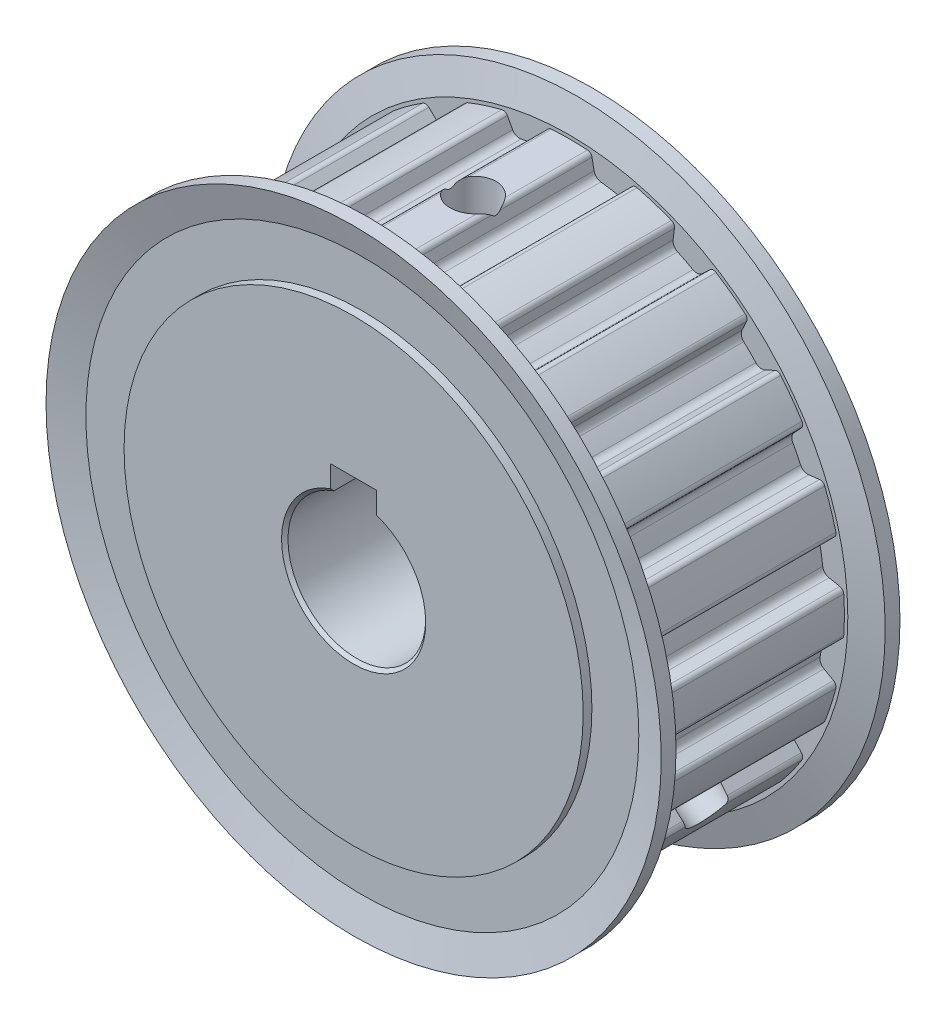
from build123d import *

# Parameters (mm, degrees)
EXTRUDE_1_DEPTH                  = 10.5
FILLET_1_R                       = 0.54
FILLET_2_R                       = 0.86
PATTERN_CIRCULAR_1_COUNT         = 20
FILLET_1_OF_PATTERN_CIRCULAR_1_R = 0.54
FILLET_2_OF_PATTERN_CIRCULAR_1_R = 0.86
CUT_EXTRUDE_2_DEPTH              = 50.127385438
CUT_EXTRUDE_2_DEPTH_BACK         = 50.127385438
CHAMFER_2_SIZE                   = 0.35
CUT_EXTRUDE_START                = 9.8
SKETCH_15_R                      = 2.5
CUT_EXTRUDE_3_DEPTH              = 40.327385438
SKETCH_16_R                      = 2.5
CUT_EXTRUDE_4_DEPTH              = 50.127385438


with BuildPart() as part:
    # 草图3 → 旋转1 (revolve)
    with BuildSketch(Plane(origin=(0, 0, 0), x_dir=(0, 0, -1), z_dir=(1, 0, 0)), mode=Mode.PRIVATE) as revolve_1_sk:
        Polygon((13, 0), (13, 25), (12.05, 25), (12.05, 30.107096992), (13, 33.5), (11.390387964, 33.5), (10.5, 30.32), (10.5, 27.8), (-10.5, 27.8), (-10.5, 30.32), (-11.390387964, 33.5), (-13, 33.5), (-12.05, 30.107096992), (-12.05, 25), (-13, 25), (-13, 0), align=None)
    revolve(revolve_1_sk.sketch.rotate(Axis((0, 0, 13), (0, 0, -1)), 90), axis=Axis((0, 0, 13), (0, 0, -1)))

    # 草图4 → 凸台-拉伸1 (add, symmetric)
    with BuildSketch(Plane.XY):
        with BuildLine():
            Line((-2.806214147, 27.658003582), (-2.381072316, 29.845168698))
            ThreePointArc((-2.381072316, 29.845168698), (0, 29.94), (2.381072316, 29.845168698))
            Line((2.381072316, 29.845168698), (2.806214147, 27.658003582))
            ThreePointArc((2.806214147, 27.658003582), (0, 27.8), (-2.806214147, 27.658003582))
        make_face()
    extrude_1 = extrude(amount=EXTRUDE_1_DEPTH, both=True)

    # 圆角1
    fillet_1_edges = [part.edges().sort_by_distance(p)[0] for p in [
        (2.381072316, 29.845168698, 0),
        (-2.381072316, 29.845168698, 0),
    ]]
    fillet(fillet_1_edges, radius=FILLET_1_R)

    # 圆角2
    fillet_2_edges = [part.edges().sort_by_distance(p)[0] for p in [
        (-2.806214147, 27.658003582, 0),
        (2.806214147, 27.658003582, 0),
    ]]
    fillet(fillet_2_edges, radius=FILLET_2_R)

    # 阵列(圆周)1: 凸台-拉伸1 ×20 about axis
    pattern_circular_1_axis = Axis((0, 0, 0), (0, 0, 1))
    for i in range(1, PATTERN_CIRCULAR_1_COUNT):
        add(extrude_1.rotate(pattern_circular_1_axis, i * 360 / PATTERN_CIRCULAR_1_COUNT))

    # 圆角1 of 阵列(圆周)1
    fillet_1_of_pattern_circular_1_edges = [part.edges().sort_by_distance(p)[0] for p in [
        (-6.958129986, 29.120233981, 0),
        (-11.48719867, 27.64865036, 0),
        (-15.616222045, 25.544807869, 0),
        (-19.468877981, 22.745689485, 0),
        (-22.745689485, 19.468877981, 0),
        (-25.544807869, 15.616222045, 0),
        (-27.64865036, 11.48719867, 0),
        (-29.120233981, 6.958129986, 0),
        (-29.845168698, 2.381072316, 0),
        (-29.845168698, -2.381072316, 0),
        (-29.120233981, -6.958129986, 0),
        (-27.64865036, -11.48719867, 0),
        (-25.544807869, -15.616222045, 0),
        (-22.745689485, -19.468877981, 0),
        (-19.468877981, -22.745689485, 0),
        (-15.616222045, -25.544807869, 0),
        (-11.48719867, -27.64865036, 0),
        (-6.958129986, -29.120233981, 0),
        (-2.381072316, -29.845168698, 0),
        (2.381072316, -29.845168698, 0),
        (6.958129986, -29.120233981, 0),
        (11.48719867, -27.64865036, 0),
        (15.616222045, -25.544807869, 0),
        (19.468877981, -22.745689485, 0),
        (22.745689485, -19.468877981, 0),
        (25.544807869, -15.616222045, 0),
        (27.64865036, -11.48719867, 0),
        (29.120233981, -6.958129986, 0),
        (29.845168698, -2.381072316, 0),
        (29.845168698, 2.381072316, 0),
        (29.120233981, 6.958129986, 0),
        (27.64865036, 11.48719867, 0),
        (25.544807869, 15.616222045, 0),
        (22.745689485, 19.468877981, 0),
        (19.468877981, 22.745689485, 0),
        (15.616222045, 25.544807869, 0),
        (11.48719867, 27.64865036, 0),
        (6.958129986, 29.120233981, 0),
    ]]
    fillet(fillet_1_of_pattern_circular_1_edges, radius=FILLET_1_OF_PATTERN_CIRCULAR_1_R)

    # 圆角2 of 阵列(圆周)1
    fillet_2_of_pattern_circular_1_edges = [part.edges().sort_by_distance(p)[0] for p in [
        (-11.215661388, 25.437156673, 0),
        (-5.877924887, 27.171492396, 0),
        (-18.527241549, 20.726343638, 0),
        (-13.986691679, 24.025246219, 0),
        (-24.025246219, 13.986691679, 0),
        (-20.726343638, 18.527241549, 0),
        (-27.171492396, 5.877924887, 0),
        (-25.437156673, 11.215661388, 0),
        (-27.658003582, -2.806214147, 0),
        (-27.658003582, 2.806214147, 0),
        (-25.437156673, -11.215661388, 0),
        (-27.171492396, -5.877924887, 0),
        (-20.726343638, -18.527241549, 0),
        (-24.025246219, -13.986691679, 0),
        (-13.986691679, -24.025246219, 0),
        (-18.527241549, -20.726343638, 0),
        (-5.877924887, -27.171492396, 0),
        (-11.215661388, -25.437156673, 0),
        (2.806214147, -27.658003582, 0),
        (-2.806214147, -27.658003582, 0),
        (11.215661388, -25.437156673, 0),
        (5.877924887, -27.171492396, 0),
        (18.527241549, -20.726343638, 0),
        (13.986691679, -24.025246219, 0),
        (24.025246219, -13.986691679, 0),
        (20.726343638, -18.527241549, 0),
        (27.171492396, -5.877924887, 0),
        (25.437156673, -11.215661388, 0),
        (27.658003582, 2.806214147, 0),
        (27.658003582, -2.806214147, 0),
        (25.437156673, 11.215661388, 0),
        (27.171492396, 5.877924887, 0),
        (20.726343638, 18.527241549, 0),
        (24.025246219, 13.986691679, 0),
        (13.986691679, 24.025246219, 0),
        (18.527241549, 20.726343638, 0),
        (5.877924887, 27.171492396, 0),
        (11.215661388, 25.437156673, 0),
    ]]
    fillet(fillet_2_of_pattern_circular_1_edges, radius=FILLET_2_OF_PATTERN_CIRCULAR_1_R)

    # 草图9 → 切除-拉伸2 (cut, two sides: drawn at the far end of the back side and taken through both)
    with BuildSketch(Plane.XY.offset(-CUT_EXTRUDE_2_DEPTH_BACK)):
        with BuildLine():
            Line((-2.5, 7.071067812), (-2.5, 9.8))
            Line((-2.5, 9.8), (2.5, 9.8))
            Line((2.5, 9.8), (2.5, 7.071067812))
            ThreePointArc((2.5, 7.071067812), (0, -7.5), (-2.5, 7.071067812))
        make_face()
    extrude(amount=CUT_EXTRUDE_2_DEPTH + CUT_EXTRUDE_2_DEPTH_BACK, mode=Mode.SUBTRACT)

    # 倒角2
    chamfer_2_edges = [part.edges().sort_by_distance(p)[0] for p in [
        (0, -7.5, -13),
        (0, -7.5, 13),
    ]]
    chamfer(chamfer_2_edges, length=CHAMFER_2_SIZE)

    # 草图15 → 切除-拉伸3 (cut, through all)
    with BuildSketch(Plane(origin=(0, 0, 0), x_dir=(1, 0, 0), z_dir=(0, 1, 0)).offset(CUT_EXTRUDE_START)):
        with Locations(Location((0, 0, 0), (0, 0, 141.823189183))):
            Circle(SKETCH_15_R)
    extrude(amount=CUT_EXTRUDE_3_DEPTH, mode=Mode.SUBTRACT)

    # 草图16 → 切除-拉伸4 (cut, through all)
    with BuildSketch(Plane(origin=(0, 0, 0), x_dir=(-0.499999999999998, -0.8660254037844398, 0), z_dir=(-0.8660254037844398, 0.499999999999998, 0))):
        Circle(SKETCH_16_R)
    extrude(amount=-CUT_EXTRUDE_4_DEPTH, mode=Mode.SUBTRACT)


solid = part.part
